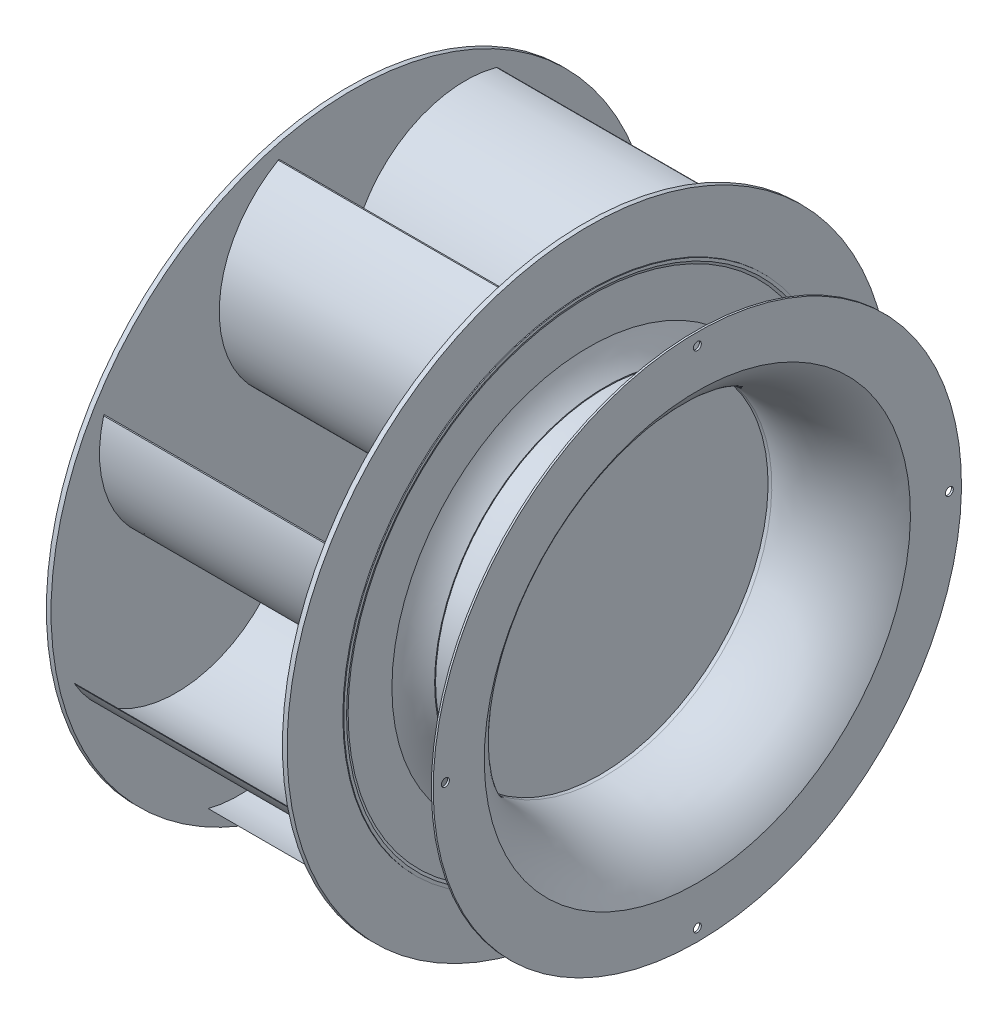
from build123d import *

# Parameters (mm, degrees)
SKETCH2_R         = 322
EXTRUDE1_DEPTH    = 5
SKETCH9_R         = 317
SKETCH9_R_2       = 100
EXTRUDE7_DEPTH    = 3
SKETCH3_R         = 322
EXTRUDE2_DEPTH    = 5
EXTRUDE3_DEPTH    = 252
CIRPATTERN1_COUNT = 8
SKETCH7_R         = 4.25
EXTRUDE5_DEPTH    = 5
CIRPATTERN2_COUNT = 4
SKETCH8_R         = 5
EXTRUDE6_DEPTH    = 90
CIRPATTERN3_COUNT = 8


with BuildPart() as part:
    # Sketch1 → Revolve1 (revolve)
    with BuildSketch(Plane.XY, mode=Mode.PRIVATE) as revolve1_sk:
        with BuildLine():
            Line((0, 0), (0, 109))
            ThreePointArc((0, 109), (1.464466094, 112.535533906), (5, 114))
            Line((5, 114), (70, 114))
            Line((70, 114), (70, 138))
            Line((70, 138), (90, 138))
            Line((90, 138), (90, 98))
            Line((90, 98), (95, 98))
            Line((95, 98), (95, 133))
            Line((95, 133), (105, 133))
            Line((105, 133), (105, 98))
            Line((105, 98), (129, 98))
            Line((129, 98), (129, 0))
            Line((129, 0), (0, 0))
        make_face()
    revolve(revolve1_sk.sketch.rotate(Axis((0, 0, 0), (1, 0, 0)), 90), axis=Axis((0, 0, 0), (1, 0, 0)))

    # Sketch2 → Extrude1 (add)
    with BuildSketch(Plane(origin=(129, 0, 0), x_dir=(0, 0, -1), z_dir=(1, 0, 0))):
        Circle(SKETCH2_R)
    extrude(amount=EXTRUDE1_DEPTH)

    # Sketch9 → Extrude7 (cut)
    with BuildSketch(Plane.ZY.offset(-129)):
        Circle(SKETCH9_R)
        Circle(SKETCH9_R_2, mode=Mode.SUBTRACT)
    extrude(amount=-EXTRUDE7_DEPTH, mode=Mode.SUBTRACT)



with BuildPart() as body_2:
    # Sketch3 → Extrude2 (new body)
    with BuildSketch(Plane(origin=(381, 0, 0), x_dir=(0, 0, -1), z_dir=(1, 0, 0))):
        Circle(SKETCH3_R)
    extrude(amount=EXTRUDE2_DEPTH)


with BuildPart() as part_1:
    add(part.part)

    add(body_2.part)  # Extrude3 merges body 2
    # Sketch4 → Extrude3 (add)
    with BuildSketch(Plane(origin=(134, 0, 0), x_dir=(0, 0, -1), z_dir=(1, 0, 0))):
        with BuildLine():
            Line((0, 112.5), (0.866025404, 112))
            ThreePointArc((0.866025404, 112), (33.143390798, 233.195288477), (154.366025404, 265.369798962))
            Line((154.366025404, 265.369798962), (153.5, 265.869798962))
            ThreePointArc((153.5, 265.869798962), (32.277365394, 233.695288477), (0, 112.5))
        make_face()
    extrude3 = extrude(amount=EXTRUDE3_DEPTH)

    # CirPattern1: Extrude3 ×8 about axis
    cirpattern1_axis = Axis((0, 0, 0), (1, 0, 0))
    for i in range(1, CIRPATTERN1_COUNT):
        add(extrude3.rotate(cirpattern1_axis, i * 360 / CIRPATTERN1_COUNT))

    # Sketch5 → Revolve2 (revolve)
    with BuildSketch(Plane.XY, mode=Mode.PRIVATE) as revolve2_sk:
        with BuildLine():
            Line((386, 262.5), (387, 262.5))
            Line((387, 262.5), (387, 259.5))
            ThreePointArc((387, 259.5), (383.626238522, 218.378520193), (404, 182.5))
            Line((404, 182.5), (404, 181.5))
            ThreePointArc((404, 181.5), (382.750164416, 217.673114865), (386, 259.5))
            Line((386, 259.5), (386, 262.5))
        make_face()
    revolve(revolve2_sk.sketch.rotate(Axis((0, 0, 0), (1, 0, 0)), 90), axis=Axis((0, 0, 0), (1, 0, 0)))

    # Sketch8 → Extrude6 (cut)
    with BuildSketch(Plane(origin=(0, 0, 0), x_dir=(0, 0, -1), z_dir=(1, 0, 0))):
        with Locations(Location((0, 126, 0), (0, 0, 180))):
            Circle(SKETCH8_R)
    extrude6 = extrude(amount=EXTRUDE6_DEPTH, mode=Mode.SUBTRACT)

    # CirPattern3: Extrude6 ×8 about axis
    cirpattern3_axis = Axis((0, 0, 0), (1, 0, 0))
    for i in range(1, CIRPATTERN3_COUNT):
        add(extrude6.rotate(cirpattern3_axis, i * 360 / CIRPATTERN3_COUNT), mode=Mode.SUBTRACT)


with BuildPart() as body_2_2:
    # Sketch6 → Revolve3 (revolve)
    with BuildSketch(Plane.XY, mode=Mode.PRIVATE) as revolve3_sk:
        with BuildLine():
            Line((502, 282), (500, 282))
            Line((500, 282), (500, 227.5))
            ThreePointArc((500, 227.5), (457.763122811, 190.091607925), (402, 181.5))
            Line((402, 181.5), (398, 181.5))
            Line((398, 181.5), (398, 179.5))
            Line((398, 179.5), (402, 179.5))
            ThreePointArc((402, 179.5), (459.265305263, 188.363947369), (502, 227.5))
            Line((502, 227.5), (502, 282))
        make_face()
    revolve(revolve3_sk.sketch.rotate(Axis((0, 0, 0), (1, 0, 0)), 180), axis=Axis((0, 0, 0), (1, 0, 0)))

    # Sketch7 → Extrude5 (cut)
    with BuildSketch(Plane(origin=(502, 0, 0), x_dir=(0, 0, -1), z_dir=(1, 0, 0))):
        with Locations((0, 269)):
            Circle(SKETCH7_R)
    extrude5 = extrude(amount=-EXTRUDE5_DEPTH, mode=Mode.SUBTRACT)

    # CirPattern2: Extrude5 ×4 about axis
    cirpattern2_axis = Axis((0, 0, 0), (1, 0, 0))
    for i in range(1, CIRPATTERN2_COUNT):
        add(extrude5.rotate(cirpattern2_axis, i * 360 / CIRPATTERN2_COUNT), mode=Mode.SUBTRACT)


solid = Compound([part_1.part, body_2_2.part])
